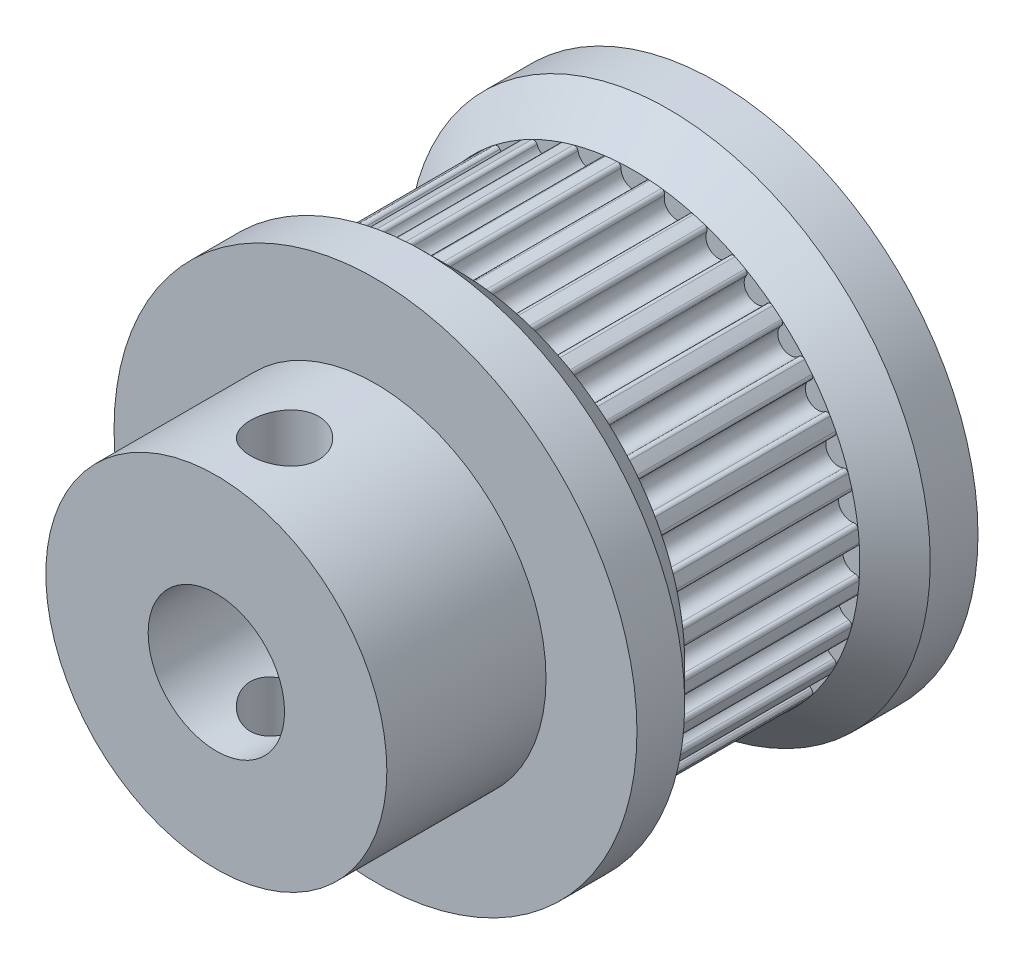
from build123d import *

# Parameters (mm, degrees)
SKETCH2_R               = 0.55
CUT_EXTRUDE1_DEPTH      = 7.7
FILLET1_R               = 0.16
SKETCH3_R               = 7.5
SKETCH3_R_2             = 3
BOSS_EXTRUDE1_DEPTH     = 7
CUT_EXTRUDE2_DEPTH      = 28.358728041
CUT_EXTRUDE2_DEPTH_BACK = 28.358728041
SKETCH4_R               = 1.5
ECHELLE1_SCALE          = 2
ECHELLE2_SCALE          = 0.25


with BuildPart() as part:
    # Sketch1 → Revolve1 (revolve)
    with BuildSketch(Plane(origin=(0, 0, 0), x_dir=(0, 0, -1), z_dir=(1, 0, 0)), mode=Mode.PRIVATE) as revolve1_sk:
        Polygon((-3.65, 9.95), (-11.35, 9.95), (-12.9, 11.5), (-15, 11.5), (-15, 3), (0, 3), (0, 11.5), (-2.1, 11.5), align=None)
    revolve(revolve1_sk.sketch.rotate(Axis((0, 0, 0), (0, 0, 1)), 90), axis=Axis((0, 0, 0), (0, 0, 1)))

    # Sketch2 → Cut-Extrude1 (cut)
    with BuildSketch(Plane.XY.offset(3.65)):
        with Locations((0, 9.75)):
            Circle(SKETCH2_R)
        with Locations((1.90213064, 9.562656484)):
            Circle(SKETCH2_R)
        with Locations((3.731163466, 9.007825442)):
            Circle(SKETCH2_R)
        with Locations((5.416809772, 8.10682872)):
            Circle(SKETCH2_R)
        with Locations((6.894291117, 6.894291117)):
            Circle(SKETCH2_R)
        with Locations((8.10682872, 5.416809772)):
            Circle(SKETCH2_R)
        with Locations((9.007825442, 3.731163466)):
            Circle(SKETCH2_R)
        with Locations((9.562656484, 1.90213064)):
            Circle(SKETCH2_R)
        with Locations((9.75, 0)):
            Circle(SKETCH2_R)
        with Locations((9.562656484, -1.90213064)):
            Circle(SKETCH2_R)
        with Locations((9.007825442, -3.731163466)):
            Circle(SKETCH2_R)
        with Locations((8.10682872, -5.416809772)):
            Circle(SKETCH2_R)
        with Locations((6.894291117, -6.894291117)):
            Circle(SKETCH2_R)
        with Locations((5.416809772, -8.10682872)):
            Circle(SKETCH2_R)
        with Locations((3.731163466, -9.007825442)):
            Circle(SKETCH2_R)
        with Locations((1.90213064, -9.562656484)):
            Circle(SKETCH2_R)
        with Locations((0, -9.75)):
            Circle(SKETCH2_R)
        with Locations((-1.90213064, -9.562656484)):
            Circle(SKETCH2_R)
        with Locations((-3.731163466, -9.007825442)):
            Circle(SKETCH2_R)
        with Locations((-5.416809772, -8.10682872)):
            Circle(SKETCH2_R)
        with Locations((-6.894291117, -6.894291117)):
            Circle(SKETCH2_R)
        with Locations((-8.10682872, -5.416809772)):
            Circle(SKETCH2_R)
        with Locations((-9.007825442, -3.731163466)):
            Circle(SKETCH2_R)
        with Locations((-9.562656484, -1.90213064)):
            Circle(SKETCH2_R)
        with Locations((-9.75, 0)):
            Circle(SKETCH2_R)
        with Locations((-9.562656484, 1.90213064)):
            Circle(SKETCH2_R)
        with Locations((-9.007825442, 3.731163466)):
            Circle(SKETCH2_R)
        with Locations((-8.10682872, 5.416809772)):
            Circle(SKETCH2_R)
        with Locations((-6.894291117, 6.894291117)):
            Circle(SKETCH2_R)
        with Locations((-5.416809772, 8.10682872)):
            Circle(SKETCH2_R)
        with Locations((-3.731163466, 9.007825442)):
            Circle(SKETCH2_R)
        with Locations((-1.90213064, 9.562656484)):
            Circle(SKETCH2_R)
    extrude(amount=CUT_EXTRUDE1_DEPTH, mode=Mode.SUBTRACT)

    # Fillet1
    fillet1_edges = [part.edges().sort_by_distance(p)[0] for p in [
        (-8.982163863, 4.280564488, 7.5),
        (-9.378165154, 3.324532801, 7.5),
        (-9.644670808, 2.445981401, 7.5),
        (-9.846550515, 1.431063575, 7.5),
        (-9.936538462, 0.517400621, 7.5),
        (-9.936538462, -0.517400621, 7.5),
        (-9.846550515, -1.431063575, 7.5),
        (-9.644670808, -2.445981401, 7.5),
        (-9.378165154, -3.324532801, 7.5),
        (-8.982163863, -4.280564488, 7.5),
        (-8.549382166, -5.090242095, 7.5),
        (-7.974477399, -5.950647882, 7.5),
        (-7.392051215, -6.66033624, 7.5),
        (-6.66033624, -7.392051215, 7.5),
        (-5.950647882, -7.974477399, 7.5),
        (-5.090242095, -8.549382166, 7.5),
        (-4.280564488, -8.982163863, 7.5),
        (-3.324532801, -9.378165154, 7.5),
        (-2.445981401, -9.644670808, 7.5),
        (-1.431063575, -9.846550515, 7.5),
        (-0.517400621, -9.936538462, 7.5),
        (0.517400621, -9.936538462, 7.5),
        (1.431063575, -9.846550515, 7.5),
        (2.445981401, -9.644670808, 7.5),
        (3.324532801, -9.378165154, 7.5),
        (4.280564488, -8.982163863, 7.5),
        (5.090242095, -8.549382166, 7.5),
        (5.950647882, -7.974477399, 7.5),
        (6.66033624, -7.392051215, 7.5),
        (7.392051215, -6.66033624, 7.5),
        (7.974477399, -5.950647882, 7.5),
        (8.549382166, -5.090242095, 7.5),
        (8.982163863, -4.280564488, 7.5),
        (9.378165154, -3.324532801, 7.5),
        (9.644670808, -2.445981401, 7.5),
        (9.846550515, -1.431063575, 7.5),
        (9.936538462, -0.517400621, 7.5),
        (9.936538462, 0.517400621, 7.5),
        (9.846550515, 1.431063575, 7.5),
        (9.644670808, 2.445981401, 7.5),
        (9.378165154, 3.324532801, 7.5),
        (8.982163863, 4.280564488, 7.5),
        (8.549382166, 5.090242095, 7.5),
        (7.974477399, 5.950647882, 7.5),
        (7.392051215, 6.66033624, 7.5),
        (6.66033624, 7.392051215, 7.5),
        (5.950647882, 7.974477399, 7.5),
        (5.090242095, 8.549382166, 7.5),
        (4.280564488, 8.982163863, 7.5),
        (3.324532801, 9.378165154, 7.5),
        (2.445981401, 9.644670808, 7.5),
        (1.431063575, 9.846550515, 7.5),
        (0.517400621, 9.936538462, 7.5),
        (-0.517400621, 9.936538462, 7.5),
        (-1.431063575, 9.846550515, 7.5),
        (-2.445981401, 9.644670808, 7.5),
        (-3.324532801, 9.378165154, 7.5),
        (-4.280564488, 8.982163863, 7.5),
        (-5.090242095, 8.549382166, 7.5),
        (-5.950647882, 7.974477399, 7.5),
        (-6.66033624, 7.392051215, 7.5),
        (-7.392051215, 6.66033624, 7.5),
        (-7.974477399, 5.950647882, 7.5),
        (-8.549382166, 5.090242095, 7.5),
    ]]
    fillet(fillet1_edges, radius=FILLET1_R)

    # Sketch3 → Boss-Extrude1 (add)
    with BuildSketch(Plane.XY.offset(15)):
        Circle(SKETCH3_R)
        with Locations(Location((0, 0, 0), (0, 0, 180))):
            Circle(SKETCH3_R_2, mode=Mode.SUBTRACT)
    extrude(amount=BOSS_EXTRUDE1_DEPTH)

    # Sketch4 → Cut-Extrude2 (cut, two sides: drawn at the far end of the back side and taken through both)
    with BuildSketch(Plane(origin=(0, 0, 0), x_dir=(1, 0, 0), z_dir=(0, 1, 0)).offset(-CUT_EXTRUDE2_DEPTH_BACK)):
        with Locations(Location((0, -19, 0), (0, 0, 270))):
            Circle(SKETCH4_R)
    extrude(amount=CUT_EXTRUDE2_DEPTH + CUT_EXTRUDE2_DEPTH_BACK, mode=Mode.SUBTRACT)


with BuildPart() as part_1:
    # Echelle1: scaled about (1.869e-06, 0, 9.395313696)
    add(part.part.scale(ECHELLE1_SCALE).moved(Location((-1.869e-06, 0, -9.395313696))))


with BuildPart() as part_2:
    # Echelle2: scaled about (1.868e-06, 0, 9.395313695)
    add(part_1.part.scale(ECHELLE2_SCALE).moved(Location((1.401e-06, 0, 7.046485271))))


solid = part_2.part
